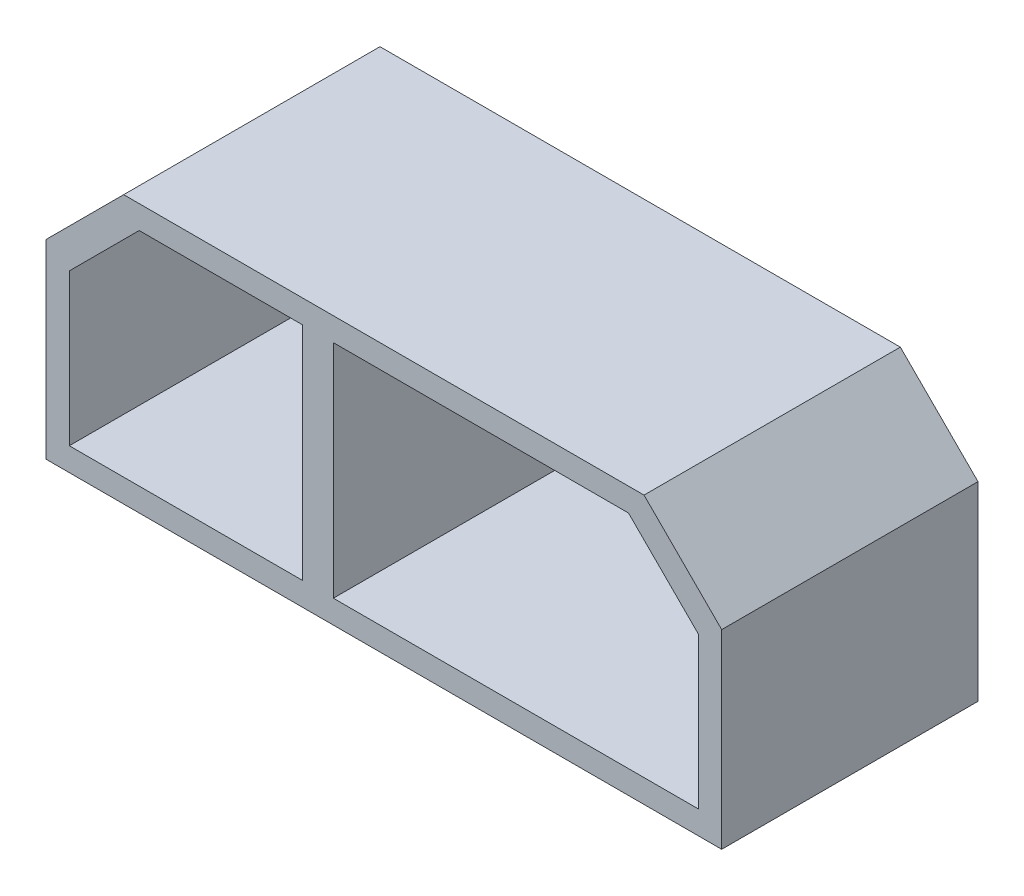
from build123d import *

# Parameters (mm, degrees)
SKETCH_1_W           = 81
SKETCH_1_H           = 28.5
EXTRUDE_1_DEPTH      = 3
EXTRUDE_2_DEPTH      = 30
EXTRUDE_2_DEPTH_BACK = 3
SKETCH_2_W           = 87
SKETCH_2_H           = 34.5
SKETCH_2_W_2         = 81
SKETCH_2_H_2         = 28.5
SKETCH_3_W           = 4
SKETCH_3_H           = 28.5
EXTRUDE_3_DEPTH      = 30
EXTRUDE_4_DEPTH      = 30
CHAMFER_1_SIZE       = 10


with BuildPart() as part:
    # 草图1 → 凸台-拉伸1 (new body)
    with BuildSketch(Plane.XY):
        with Locations((40.5, 14.25)):
            Rectangle(SKETCH_1_W, SKETCH_1_H)
    extrude(amount=EXTRUDE_1_DEPTH)

    # 草图2 → 凸台-拉伸2 (add, two sides: drawn at the far end of the back side and taken through both)
    with BuildSketch(Plane.XY.offset(3).offset(-EXTRUDE_2_DEPTH_BACK)):
        with Locations((40.5, 14.25)):
            Rectangle(SKETCH_2_W, SKETCH_2_H)
        with Locations((40.5, 14.25)):
            Rectangle(SKETCH_2_W_2, SKETCH_2_H_2, mode=Mode.SUBTRACT)
    extrude(amount=EXTRUDE_2_DEPTH + EXTRUDE_2_DEPTH_BACK)

    # 草图3 → 凸台-拉伸3 (add)
    with BuildSketch(Plane.XY.offset(3)):
        with Locations((32, 14.25)):
            Rectangle(SKETCH_3_W, SKETCH_3_H)
    extrude(amount=EXTRUDE_3_DEPTH)

    # 草图4 → 凸台-拉伸4 (add)
    with BuildSketch(Plane.XY.offset(3)):
        Polygon((-3, 16.5), (12, 31.5), (-3, 31.5), align=None)
        Polygon((69, 31.5), (84, 16.5), (84, 31.5), align=None)
    extrude(amount=EXTRUDE_4_DEPTH)

    # 倒角1
    chamfer_1_edges = [part.edges().sort_by_distance(p)[0] for p in [
        (-3, 31.5, 16.5),
        (84, 31.5, 16.5),
    ]]
    chamfer(chamfer_1_edges, length=CHAMFER_1_SIZE)


solid = part.part
